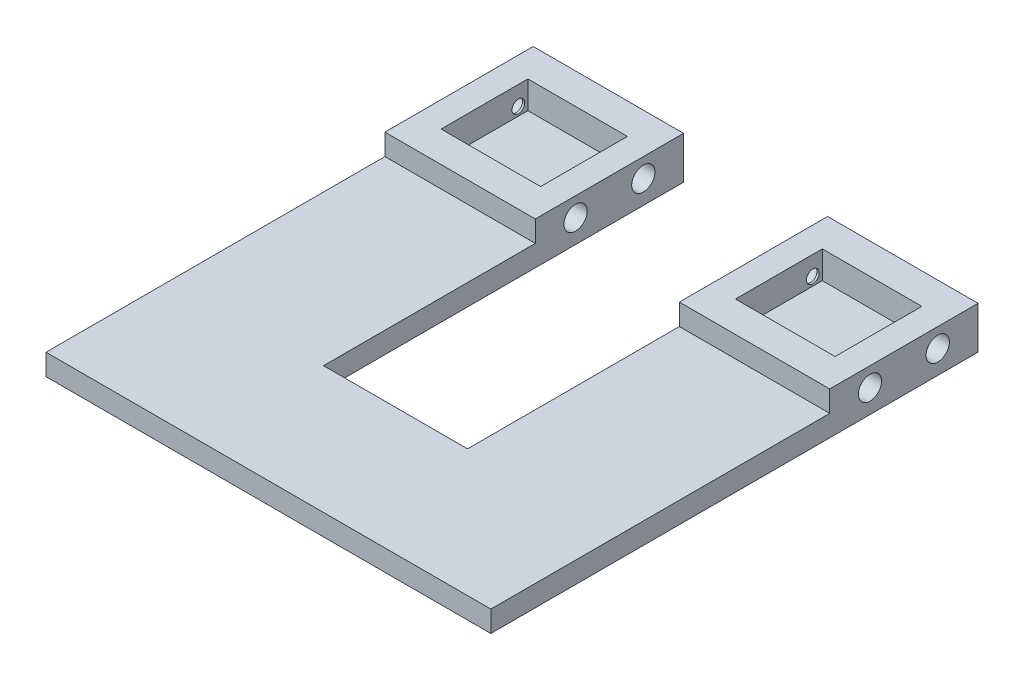
from build123d import *

# Parameters (mm, degrees)
SKETCH1_W           = 35.5
SKETCH1_H           = 35
SKETCH1_W_2         = 23.5
SKETCH1_H_2         = 20.5
BOSS_EXTRUDE1_DEPTH = 10
SKETCH1_2_W         = 23.5
SKETCH1_2_H         = 20.5
BOSS_EXTRUDE2_DEPTH = 3.5
SKETCH2_R           = 2.75
SKETCH2_R_2         = 1.5
CUT_EXTRUDE1_DEPTH  = 5.5
SKETCH2_2_R         = 1.5
CUT_EXTRUDE2_DEPTH  = 41.822787754
CUT_EXTRUDE3_START  = -30
SKETCH2_3_R         = 2.75
SKETCH2_3_R_2       = 1.5
CUT_EXTRUDE3_DEPTH  = 5.5
BOSS_EXTRUDE3_DEPTH = 5


with BuildPart() as part:
    # Sketch1 → Boss-Extrude1 (new body)
    with BuildSketch(Plane(origin=(0, 0, 0), x_dir=(1, 0, 0), z_dir=(0, 1, 0))):
        Rectangle(SKETCH1_W, SKETCH1_H)
        Rectangle(SKETCH1_W_2, SKETCH1_H_2, mode=Mode.SUBTRACT)
    extrude(amount=BOSS_EXTRUDE1_DEPTH)

    # Sketch1<2> → Boss-Extrude2 (add)
    with BuildSketch(Plane(origin=(0, 0, 0), x_dir=(1, 0, 0), z_dir=(0, 1, 0))):
        Rectangle(SKETCH1_2_W, SKETCH1_2_H)
    extrude(amount=BOSS_EXTRUDE2_DEPTH)

    # Sketch2 → Cut-Extrude1 (cut)
    # profile 1 of 2: a face of its own
    with BuildSketch(Plane(origin=(17.75, 0, 0), x_dir=(0, 0, -1), z_dir=(1, 0, 0))):
        with Locations((-8, 5.5)):
            Circle(SKETCH2_R)
        with Locations((-8, 5.5)):
            Circle(SKETCH2_R_2, mode=Mode.SUBTRACT)
    # profile 2 of 2: a face of its own
    with BuildSketch(Plane(origin=(17.75, 0, 0), x_dir=(0, 0, -1), z_dir=(1, 0, 0))):
        with Locations((8, 5.5)):
            Circle(SKETCH2_R)
        with Locations((8, 5.5)):
            Circle(SKETCH2_R_2, mode=Mode.SUBTRACT)
    extrude(amount=-CUT_EXTRUDE1_DEPTH, mode=Mode.SUBTRACT)

    # Sketch2<2> → Cut-Extrude2 (cut, through all)
    with BuildSketch(Plane(origin=(17.75, 0, 0), x_dir=(0, 0, -1), z_dir=(1, 0, 0))):
        with Locations((-8, 5.5)):
            Circle(SKETCH2_2_R)
        with Locations((8, 5.5)):
            Circle(SKETCH2_2_R)
    extrude(amount=-CUT_EXTRUDE2_DEPTH, mode=Mode.SUBTRACT)

    # Sketch2<3> → Cut-Extrude3 (cut)
    # profile 1 of 2: a face of its own
    with BuildSketch(Plane(origin=(17.75, 0, 0), x_dir=(0, 0, -1), z_dir=(1, 0, 0)).offset(CUT_EXTRUDE3_START)):
        with Locations((-8, 5.5)):
            Circle(SKETCH2_3_R)
        with Locations((-8, 5.5)):
            Circle(SKETCH2_3_R_2, mode=Mode.SUBTRACT)
    # profile 2 of 2: a face of its own
    with BuildSketch(Plane(origin=(17.75, 0, 0), x_dir=(0, 0, -1), z_dir=(1, 0, 0)).offset(CUT_EXTRUDE3_START)):
        with Locations((8, 5.5)):
            Circle(SKETCH2_3_R)
        with Locations((8, 5.5)):
            Circle(SKETCH2_3_R_2, mode=Mode.SUBTRACT)
    extrude(amount=-CUT_EXTRUDE3_DEPTH, mode=Mode.SUBTRACT)


with BuildPart() as body_2:
    # Mirror1: mirrored copy
    add(part.part.mirror(Plane.ZY.offset(34.75)))


with BuildPart() as part_1:
    add(part.part)

    add(body_2.part)  # Boss-Extrude3 merges body 2
    # Sketch4 → Boss-Extrude3 (add)
    with BuildSketch(Plane(origin=(0, 0, 0), x_dir=(1, 0, 0), z_dir=(0, 1, 0))):
        Polygon((-51.75, -17.5), (-51.75, -67.5), (-17.75, -67.5), (-17.75, -17.5), (17.75, -17.5), (17.75, -97.5), (-87.25, -97.5), (-87.25, -17.5), align=None)
    extrude(amount=BOSS_EXTRUDE3_DEPTH)


solid = part_1.part
